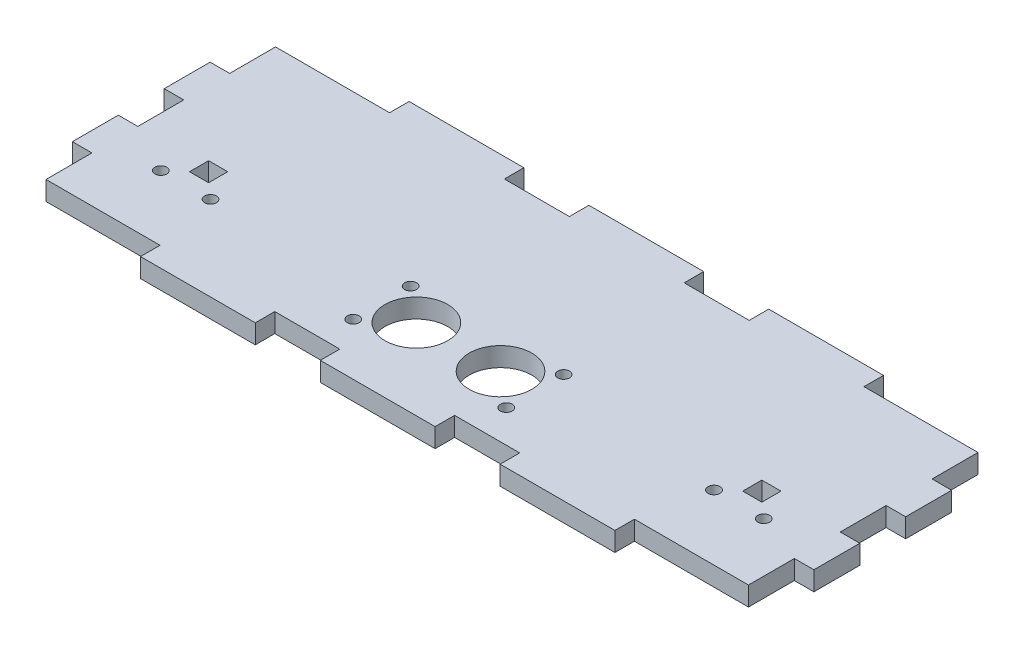
from build123d import *

# Parameters (mm, degrees)
SKETCH1_R           = 8.2
SKETCH1_R_2         = 1.55
SKETCH1_W           = 5
SKETCH1_H           = 5
BOSS_EXTRUDE1_DEPTH = 5


with BuildPart() as part:
    # Sketch1 → Boss-Extrude1 (new body)
    with BuildSketch(Plane(origin=(0, 0, 0), x_dir=(1, 0, 0), z_dir=(0, 1, 0))):
        Polygon((-87.414457831, -48), (-57.614457831, -48), (-57.614457831, -53.1), (-27.614457831, -53.1), (-27.614457831, -48), (-10.614457831, -48), (-10.614457831, -53.1), (19.385542169, -53.1), (19.385542169, -48), (36.385542169, -48), (36.385542169, -53.1), (66.385542169, -53.1), (66.385542169, -48), (96.185542169, -48), (96.185542169, -36), (101.285542169, -36), (101.285542169, -24), (96.185542169, -24), (96.185542169, -12), (101.285542169, -12), (101.285542169, 0), (96.185542169, 0), (96.185542169, 12), (66.385542169, 12), (66.385542169, 17.1), (36.385542169, 17.1), (36.385542169, 12), (19.385542169, 12), (19.385542169, 17.1), (-10.614457831, 17.1), (-10.614457831, 12), (-27.614457831, 12), (-27.614457831, 17.1), (-57.614457831, 17.1), (-57.614457831, 12), (-87.414457831, 12), (-87.414457831, 0), (-92.514457831, 0), (-92.514457831, -12), (-87.414457831, -12), (-87.414457831, -24), (-92.514457831, -24), (-92.514457831, -36), (-87.414457831, -36), align=None)
        with Locations(Location((15.385542169, -32, 0), (0, 0, 270))):
            Circle(SKETCH1_R, mode=Mode.SUBTRACT)
        with Locations(Location((-6.614457831, -32, 0), (0, 0, 90))):
            Circle(SKETCH1_R, mode=Mode.SUBTRACT)
        with Locations(Location((-15.614457831, -24.5, 0), (0, 0, 270))):
            Circle(SKETCH1_R_2, mode=Mode.SUBTRACT)
        with Locations(Location((-15.614457831, -39.5, 0), (0, 0, 270))):
            Circle(SKETCH1_R_2, mode=Mode.SUBTRACT)
        with Locations(Location((-74.414457831, -31, 0), (0, 0, 270))):
            Circle(SKETCH1_R_2, mode=Mode.SUBTRACT)
        with Locations(Location((-61.414457831, -31, 0), (0, 0, 270))):
            Circle(SKETCH1_R_2, mode=Mode.SUBTRACT)
        with Locations(Location((24.385542169, -39.5, 0), (0, 0, 90))):
            Circle(SKETCH1_R_2, mode=Mode.SUBTRACT)
        with Locations(Location((24.385542169, -24.5, 0), (0, 0, 90))):
            Circle(SKETCH1_R_2, mode=Mode.SUBTRACT)
        with Locations(Location((70.185542169, -31, 0), (0, 0, 90))):
            Circle(SKETCH1_R_2, mode=Mode.SUBTRACT)
        with Locations(Location((83.185542169, -31, 0), (0, 0, 90))):
            Circle(SKETCH1_R_2, mode=Mode.SUBTRACT)
        with Locations((-67.914457831, -25)):
            Rectangle(SKETCH1_W, SKETCH1_H, mode=Mode.SUBTRACT)
        with Locations((76.685542169, -25)):
            Rectangle(SKETCH1_W, SKETCH1_H, mode=Mode.SUBTRACT)
    extrude(amount=BOSS_EXTRUDE1_DEPTH)


solid = part.part
